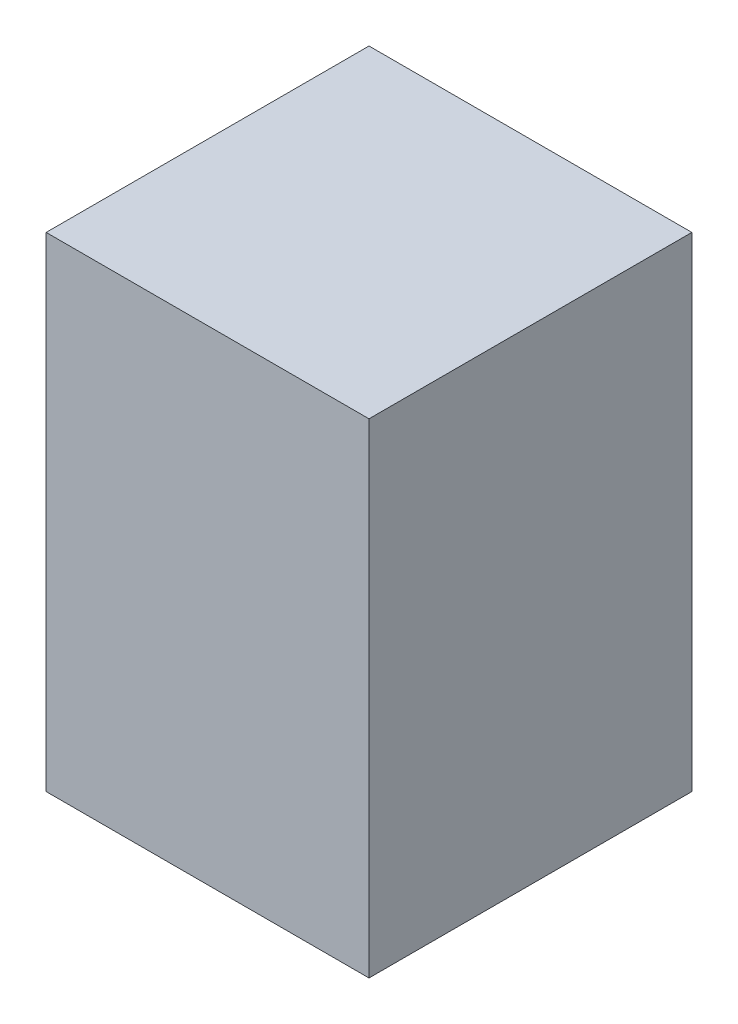
from build123d import *

# Parameters (mm, degrees)
SKETCH1_W           = 40
SKETCH1_H           = 40
BOSS_EXTRUDE1_DEPTH = 60
SKETCH3_R           = 1
BOSS_EXTRUDE2_DEPTH = 5
SKETCH4_W           = 19.244231552
SKETCH4_H           = 7.397169782
CUT_EXTRUDE1_DEPTH  = 3.75


with BuildPart() as part:
    # Sketch1 → Boss-Extrude1 (new body)
    with BuildSketch(Plane(origin=(0, 0, 0), x_dir=(1, 0, 0), z_dir=(0, 1, 0))):
        Rectangle(SKETCH1_W, SKETCH1_H)
    extrude(amount=BOSS_EXTRUDE1_DEPTH)

    # Sketch3 → Boss-Extrude2 (add, symmetric)
    with BuildSketch(Plane(origin=(0, 0, 0), x_dir=(0, 0, -1), z_dir=(1, 0, 0))):
        Polygon((-5, 0), (-2.5, -6), (2.5, -6), (5, 0), align=None)
        with Locations((0, -3)):
            Circle(SKETCH3_R, mode=Mode.SUBTRACT)
    extrude(amount=BOSS_EXTRUDE2_DEPTH, both=True)

    # Sketch4 → Cut-Extrude1 (cut, symmetric)
    with BuildSketch(Plane(origin=(0, 0, 0), x_dir=(0, 0, -1), z_dir=(1, 0, 0))):
        with Locations((0.530352838, -3.698584891)):
            Rectangle(SKETCH4_W, SKETCH4_H)
    extrude(amount=CUT_EXTRUDE1_DEPTH, both=True, mode=Mode.SUBTRACT)


solid = part.part
